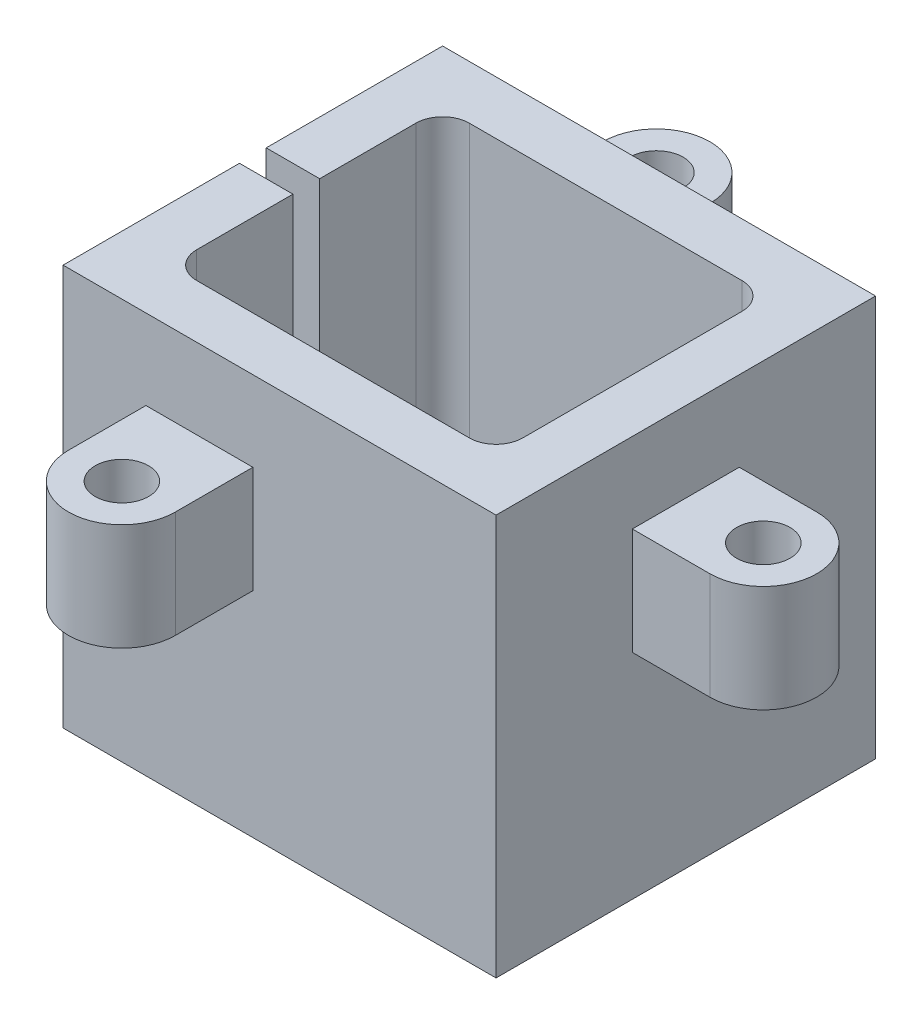
from build123d import *

# Parameters (mm, degrees)
EXTRUDE_1_DEPTH = 15
SKETCH_2_R      = 1.15
EXTRUDE_2_DEPTH = 1.5
EXTRUDE_START   = 2.5
SKETCH_2_2_R    = 1.15
EXTRUDE_3_DEPTH = 1.5
FILLET_1_R      = 1
SKETCH_4_R      = 1
EXTRUDE_5_DEPTH = 4


with BuildPart() as part:
    # 草图1 → 凸台-拉伸1 (new body)
    with BuildSketch(Plane(origin=(0, 0, 0), x_dir=(1, 0, 0), z_dir=(0, 1, 0))):
        Polygon((-2, -2), (14.2, -2), (14.2, 12.2), (-2, 12.2), (-2, 5.6), (0, 5.6), (0, 10.2), (12.2, 10.2), (12.2, 0), (0, 0), (0, 4.6), (-2, 4.6), align=None)
    extrude(amount=EXTRUDE_1_DEPTH)

    # 草图2 → 凸台-拉伸2 (add)
    with BuildSketch(Plane.XY.offset(-5.6)):
        with BuildLine():
            Line((-4, 8.5), (-2, 8.5))
            Line((-2, 8.5), (-2, 4.5))
            Line((-2, 4.5), (-4, 4.5))
            ThreePointArc((-4, 4.5), (-6, 6.5), (-4, 8.5))
        make_face()
        with Locations((-4, 6.5)):
            Circle(SKETCH_2_R, mode=Mode.SUBTRACT)
    extrude(amount=-EXTRUDE_2_DEPTH)

    # 草图2<2> → 凸台-拉伸3 (add)
    with BuildSketch(Plane.XY.offset(-5.6).offset(EXTRUDE_START)):
        with BuildLine():
            Line((-4, 8.5), (-2, 8.5))
            Line((-2, 8.5), (-2, 4.5))
            Line((-2, 4.5), (-4, 4.5))
            ThreePointArc((-4, 4.5), (-6, 6.5), (-4, 8.5))
        make_face()
        with Locations((-4, 6.5)):
            Circle(SKETCH_2_2_R, mode=Mode.SUBTRACT)
    extrude(amount=-EXTRUDE_3_DEPTH)

    # 圆角1
    fillet_1_edges = [part.edges().sort_by_distance(p)[0] for p in [
        (0, 7.5, 0),
        (12.2, 7.5, 0),
        (12.2, 7.5, -10.2),
        (0, 7.5, -10.2),
    ]]
    fillet(fillet_1_edges, radius=FILLET_1_R)

    # 草图4 → 凸台-拉伸5 (add)
    # profile 1 of 3: a face of its own
    with BuildSketch(Plane(origin=(0, 12, 0), x_dir=(1, 0, 0), z_dir=(0, 1, 0))):
        with BuildLine():
            Line((5.1, -2), (5.1, -4.9))
            ThreePointArc((5.1, -4.9), (3.1, -6.9), (1.1, -4.9))
            Line((1.1, -4.9), (1.1, -2))
            Line((1.1, -2), (5.1, -2))
        make_face()
        with Locations(Location((3.1, -4.9, 0), (0, 0, 90))):
            Circle(SKETCH_4_R, mode=Mode.SUBTRACT)
    # profile 2 of 3: a face of its own
    with BuildSketch(Plane(origin=(0, 12, 0), x_dir=(1, 0, 0), z_dir=(0, 1, 0))):
        with BuildLine():
            Line((1.1, 15.1), (1.1, 12.2))
            Line((1.1, 12.2), (5.1, 12.2))
            Line((5.1, 12.2), (5.1, 15.1))
            ThreePointArc((5.1, 15.1), (3.1, 17.1), (1.1, 15.1))
        make_face()
        with Locations(Location((3.1, 15.1, 0), (0, 0, 270))):
            Circle(SKETCH_4_R, mode=Mode.SUBTRACT)
    # profile 3 of 3: a face of its own
    with BuildSketch(Plane(origin=(0, 12, 0), x_dir=(1, 0, 0), z_dir=(0, 1, 0))):
        with BuildLine():
            Line((17.1, 7.1), (14.2, 7.1))
            Line((14.2, 7.1), (14.2, 3.1))
            Line((14.2, 3.1), (17.1, 3.1))
            ThreePointArc((17.1, 3.1), (19.1, 5.1), (17.1, 7.1))
        make_face()
        with Locations(Location((17.1, 5.1, 0), (0, 0, 270))):
            Circle(SKETCH_4_R, mode=Mode.SUBTRACT)
    extrude(amount=-EXTRUDE_5_DEPTH)


solid = part.part
